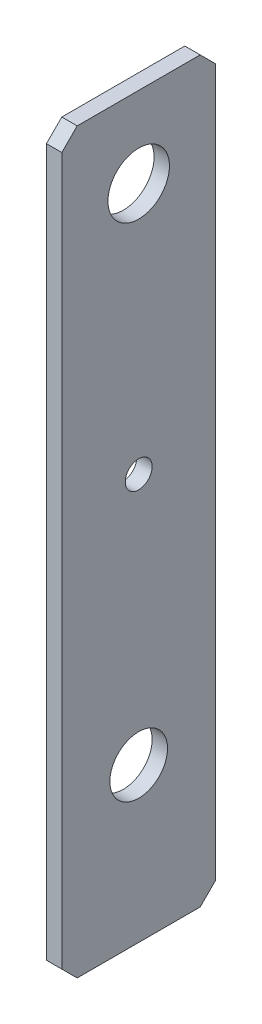
from build123d import *

# Parameters (mm, degrees)
SKETCH1_W           = 20
SKETCH1_H           = 96
BOSS_EXTRUDE1_DEPTH = 2
SKETCH2_R           = 4
SKETCH2_R_2         = 1.75
SKETCH2_R_3         = 3.75
CUT_EXTRUDE1_DEPTH  = 99.081598682
CHAMFER1_SIZE       = 2


with BuildPart() as part:
    # Sketch1 → Boss-Extrude1 (new body)
    with BuildSketch(Plane(origin=(0, 0, 0), x_dir=(0, 0, -1), z_dir=(1, 0, 0))):
        with Locations((10, 48)):
            Rectangle(SKETCH1_W, SKETCH1_H)
    extrude(amount=BOSS_EXTRUDE1_DEPTH)

    # Sketch2 → Cut-Extrude1 (cut, through all)
    with BuildSketch(Plane(origin=(2, 0, 0), x_dir=(0, 0, -1), z_dir=(1, 0, 0))):
        with Locations((10, 85.5)):
            Circle(SKETCH2_R)
        with Locations((10, 52.75)):
            Circle(SKETCH2_R_2)
        with Locations((10, 20)):
            Circle(SKETCH2_R_3)
    extrude(amount=-CUT_EXTRUDE1_DEPTH, mode=Mode.SUBTRACT)

    # Chamfer1
    chamfer1_edges = [part.edges().sort_by_distance(p)[0] for p in [
        (1, 96, 0),
        (1, 96, -20),
        (1, 0, -20),
        (1, 0, 0),
    ]]
    chamfer(chamfer1_edges, length=CHAMFER1_SIZE)


solid = part.part
